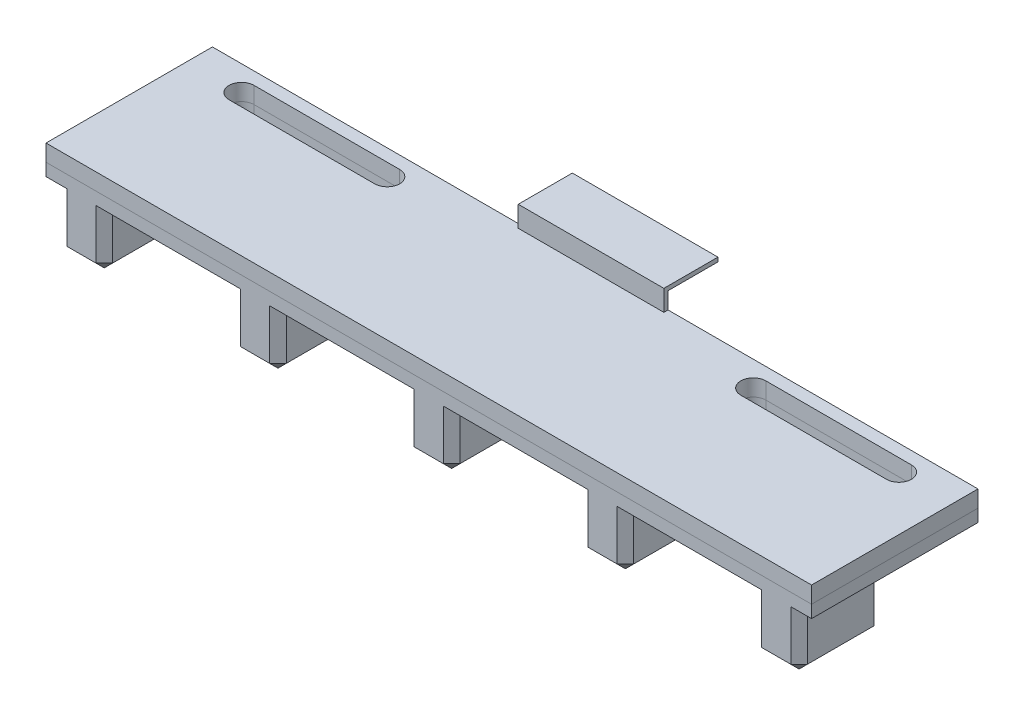
from build123d import *

# Parameters (mm, degrees)
SKETCH_1_W                         = 92
SKETCH_1_H                         = 20
EXTRUDE_1_DEPTH                    = 1.5
SKETCH_2_W                         = 5.5
SKETCH_2_H                         = 10
EXTRUDE_2_DEPTH                    = 7
CHAMFER_1_SIZE                     = 1
PATTERN_LINEAR_2_COUNT             = 5
PATTERN_LINEAR_2_PITCH             = 20.875
CHAMFER_1_OF_PATTERN_LINEAR_2_SIZE = 1
EXTRUDE_3_DEPTH                    = 8.75
CUT_EXTRUDE_1_DEPTH                = 1.5
EXTRUDE_4_DEPTH                    = 2


with BuildPart() as part:
    # 草图1 → 凸台-拉伸1 (new body)
    with BuildSketch(Plane(origin=(0, 0, 0), x_dir=(1, 0, 0), z_dir=(0, 1, 0))):
        Rectangle(SKETCH_1_W, SKETCH_1_H)
    extrude(amount=EXTRUDE_1_DEPTH)

    # 草图2 → 凸台-拉伸2 (add)
    with BuildSketch(Plane.XZ):
        with Locations((-41.75, 5)):
            Rectangle(SKETCH_2_W, SKETCH_2_H)
    extrude_2 = extrude(amount=EXTRUDE_2_DEPTH)

    # 倒角1
    chamfer_1_edges = [part.edges().sort_by_distance(p)[0] for p in [
        (-44.5, -3.5, 10),
        (-44.5, -3.5, 0),
        (-39, -3.5, 0),
        (-39, -3.5, 10),
        (-44.5, -7, 5),
        (-41.75, -7, 0),
        (-39, -7, 5),
        (-41.75, -7, 10),
    ]]
    chamfer(chamfer_1_edges, length=CHAMFER_1_SIZE)

    # 阵列(线性)2: 凸台-拉伸2 ×5
    with Locations(*[(i * PATTERN_LINEAR_2_PITCH, 0, 0) for i in range(1, PATTERN_LINEAR_2_COUNT)]):
        add(extrude_2)

    # 倒角1 of 阵列(线性)2
    chamfer_1_of_pattern_linear_2_edges = [part.edges().sort_by_distance(p)[0] for p in [
        (-23.625, -3.5, 10),
        (-23.625, -3.5, 0),
        (-18.125, -3.5, 0),
        (-18.125, -3.5, 10),
        (-23.625, -7, 5),
        (-20.875, -7, 0),
        (-18.125, -7, 5),
        (-20.875, -7, 10),
        (-2.75, -3.5, 10),
        (-2.75, -3.5, 0),
        (2.75, -3.5, 0),
        (2.75, -3.5, 10),
        (-2.75, -7, 5),
        (0, -7, 0),
        (2.75, -7, 5),
        (0, -7, 10),
        (18.125, -3.5, 10),
        (18.125, -3.5, 0),
        (23.625, -3.5, 0),
        (23.625, -3.5, 10),
        (18.125, -7, 5),
        (20.875, -7, 0),
        (23.625, -7, 5),
        (20.875, -7, 10),
        (39, -3.5, 10),
        (39, -3.5, 0),
        (44.5, -3.5, 0),
        (44.5, -3.5, 10),
        (39, -7, 5),
        (41.75, -7, 0),
        (44.5, -7, 5),
        (41.75, -7, 10),
    ]]
    chamfer(chamfer_1_of_pattern_linear_2_edges, length=CHAMFER_1_OF_PATTERN_LINEAR_2_SIZE)

    # 草图4 → 凸台-拉伸3 (add, symmetric)
    with BuildSketch(Plane(origin=(0, 0, 0), x_dir=(0, 0, -1), z_dir=(1, 0, 0))):
        Polygon((9.5, 1.5), (9.5, 6), (16, 6), (16, 5.5), (10, 5.5), (10, 1.5), align=None)
    extrude(amount=EXTRUDE_3_DEPTH, both=True)

    # 草图5 → 切除-拉伸1 (cut)
    with BuildSketch(Plane(origin=(0, 1.5, 0), x_dir=(1, 0, 0), z_dir=(0, 1, 0))):
        with BuildLine():
            Line((-39.5, 8.5), (-22, 8.5))
            ThreePointArc((-22, 8.5), (-20.5, 7), (-22, 5.5))
            Line((-22, 5.5), (-39.5, 5.5))
            ThreePointArc((-39.5, 5.5), (-41, 7), (-39.5, 8.5))
        make_face()
        with BuildLine():
            Line((39.5, 8.5), (22, 8.5))
            ThreePointArc((22, 8.5), (20.5, 7), (22, 5.5))
            Line((22, 5.5), (39.5, 5.5))
            ThreePointArc((39.5, 5.5), (41, 7), (39.5, 8.5))
        make_face()
    extrude(amount=-CUT_EXTRUDE_1_DEPTH, mode=Mode.SUBTRACT)


with BuildPart() as body_2:
    # 草图6 → 凸台-拉伸4 (new body)
    with BuildSketch(Plane(origin=(0, 1.5, 0), x_dir=(1, 0, 0), z_dir=(0, 1, 0))):
        Polygon((8.75, 9.5), (-8.75, 9.5), (-8.75, 10), (-46, 10), (-46, -10), (46, -10), (46, 10), (8.75, 10), align=None)
        with BuildLine():
            Line((39.5, 8.5), (22, 8.5))
            ThreePointArc((22, 8.5), (20.5, 7), (22, 5.5))
            Line((22, 5.5), (39.5, 5.5))
            ThreePointArc((39.5, 5.5), (41, 7), (39.5, 8.5))
        make_face(mode=Mode.SUBTRACT)
        with BuildLine():
            Line((-39.5, 5.5), (-22, 5.5))
            ThreePointArc((-22, 5.5), (-20.5, 7), (-22, 8.5))
            Line((-22, 8.5), (-39.5, 8.5))
            ThreePointArc((-39.5, 8.5), (-41, 7), (-39.5, 5.5))
        make_face(mode=Mode.SUBTRACT)
    extrude(amount=EXTRUDE_4_DEPTH)


solid = Compound([part.part, body_2.part])
